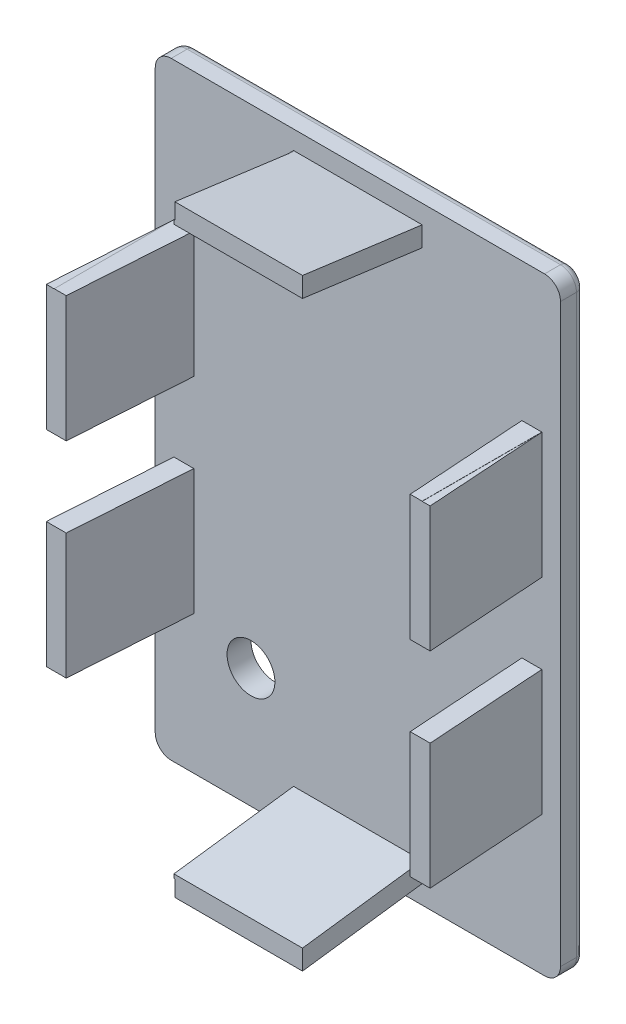
from build123d import *

# Parameters (mm, degrees)
CROQUIS1_W              = 50.8
CROQUIS1_H              = 76.2
SALIENTE_EXTRUIR1_DEPTH = 18
CROQUIS2_W              = 50.8
CROQUIS2_H              = 76.2
CROQUIS2_W_2            = 46.12
CROQUIS2_H_2            = 71.52
CROQUIS2_W_3            = 38.8
CROQUIS2_H_3            = 64.2
CORTAR_EXTRUIR1_DEPTH   = 15
CORTAR_EXTRUIR8_DEPTH   = 15
SALIENTE_EXTRUIR3_DEPTH = 41.5
CORTAR_EXTRUIR9_DEPTH   = 51.5
CORTAR_EXTRUIR10_DEPTH  = 51.5
SALIENTE_EXTRUIR4_DEPTH = 16
CORTAR_EXTRUIR11_DEPTH  = 16.5
REDONDEO3_R             = 2
REDONDEO4_R             = 1
CROQUIS15_W             = 48.12
CROQUIS15_H             = 10
CORTAR_EXTRUIR12_DEPTH  = 15
CROQUIS16_W             = 8
CROQUIS16_H             = 1.5
CORTAR_EXTRUIR13_DEPTH  = 2
CROQUIS17_R             = 3
CORTAR_EXTRUIR14_DEPTH  = 10


with BuildPart() as part:
    # Croquis1 → Saliente-Extruir1 (new body)
    with BuildSketch(Plane.XY):
        Rectangle(CROQUIS1_W, CROQUIS1_H)
    extrude(amount=SALIENTE_EXTRUIR1_DEPTH)

    # Croquis2 → Cortar-Extruir1 (cut)
    # profile 1 of 2: a face of its own
    with BuildSketch(Plane.XY.offset(18)):
        Rectangle(CROQUIS2_W, CROQUIS2_H)
        Rectangle(CROQUIS2_W_2, CROQUIS2_H_2, mode=Mode.SUBTRACT)
    # profile 2 of 2: a face of its own
    with BuildSketch(Plane.XY.offset(18)):
        Rectangle(CROQUIS2_W_3, CROQUIS2_H_3)
    extrude(amount=-CORTAR_EXTRUIR1_DEPTH, mode=Mode.SUBTRACT)

    # Croquis6 → Cortar-Extruir8 (cut)
    with BuildSketch(Plane.XY.offset(18)):
        Polygon((-23.06, 35.76), (-8.06, 35.76), (-8.06, 32.1), (-19.4, 32.1), (-19.4, 20.76), (-23.06, 20.76), align=None)
        Polygon((23.06, 35.76), (8.06, 35.76), (8.06, 32.1), (19.4, 32.1), (19.4, 20.76), (23.06, 20.76), align=None)
        Polygon((-23.06, -35.76), (-23.06, -20.76), (-19.4, -20.76), (-19.4, -32.1), (-8.06, -32.1), (-8.06, -35.76), align=None)
        Polygon((23.06, -35.76), (8.06, -35.76), (8.06, -32.1), (19.4, -32.1), (19.4, -20.76), (23.06, -20.76), align=None)
    extrude(amount=-CORTAR_EXTRUIR8_DEPTH, mode=Mode.SUBTRACT)

    # Croquis10 → Saliente-Extruir3 (add)
    with BuildSketch(Plane(origin=(0, -20.76, 0), x_dir=(-1, 0, 0), z_dir=(0, -1, 0))):
        Polygon((23.06, -18), (24.06, -18), (23.06, -3), align=None)
        Polygon((-23.06, -18), (-24.06, -18), (-23.06, -3), align=None)
    extrude(amount=-SALIENTE_EXTRUIR3_DEPTH)

    # Croquis11 → Cortar-Extruir9 (cut)
    with BuildSketch(Plane.XZ.offset(20.76)):
        Polygon((-19.4, 18), (-21.56, 18), (-20.56, 3), (-19.4, 3), align=None)
    extrude(amount=-CORTAR_EXTRUIR9_DEPTH, mode=Mode.SUBTRACT)

    # Croquis12 → Cortar-Extruir10 (cut)
    with BuildSketch(Plane.XZ.offset(20.76)):
        Polygon((19.4, 18), (19.4, 3), (20.56, 3), (21.56, 18), align=None)
    extrude(amount=-CORTAR_EXTRUIR10_DEPTH, mode=Mode.SUBTRACT)

    # Croquis13 → Saliente-Extruir4 (add)
    with BuildSketch(Plane(origin=(8.06, 0, 0), x_dir=(0, 0, -1), z_dir=(1, 0, 0))):
        Polygon((-18, -35.76), (-18, -37.76), (-3, -35.76), align=None)
        Polygon((-18, 35.76), (-18, 37.76), (-3, 35.76), align=None)
    extrude(amount=-SALIENTE_EXTRUIR4_DEPTH)

    # Croquis14 → Cortar-Extruir11 (cut)
    with BuildSketch(Plane(origin=(8.06, 0, 0), x_dir=(0, 0, -1), z_dir=(1, 0, 0))):
        Polygon((-3, -32.1), (-18, -32.1), (-18, -35.26), (-3, -33.26), align=None)
        Polygon((-18, 32.1), (-18, 35.26), (-3, 33.26), (-3, 32.1), align=None)
    extrude(amount=-CORTAR_EXTRUIR11_DEPTH, mode=Mode.SUBTRACT)

    # Redondeo3
    redondeo3_edges = [part.edges().sort_by_distance(p)[0] for p in [
        (-25.4, 38.1, 1.5),
        (25.4, 38.1, 1.5),
        (25.4, -38.1, 1.5),
        (-25.4, -38.1, 1.5),
    ]]
    fillet(redondeo3_edges, radius=REDONDEO3_R)

    # Redondeo4
    redondeo4_edges = [part.edges().sort_by_distance(p)[0] for p in [
        (0, 38.1, 0),
        (-25.4, 0, 0),
        (25.4, 0, 0),
        (0, -38.1, 0),
        (24.814213562, -37.514213562, 0),
        (-24.814213562, -37.514213562, 0),
        (-24.814213562, 37.514213562, 0),
        (24.814213562, 37.514213562, 0),
    ]]
    fillet(redondeo4_edges, radius=REDONDEO4_R)

    # Croquis15 → Cortar-Extruir12 (cut)
    with BuildSketch(Plane.XY.offset(18)):
        with Locations((0, -0.01)):
            Rectangle(CROQUIS15_W, CROQUIS15_H)
    extrude(amount=-CORTAR_EXTRUIR12_DEPTH, mode=Mode.SUBTRACT)

    # Croquis16 → Cortar-Extruir13 (cut)
    with BuildSketch(Plane.XZ.offset(38.1)):
        with Locations((0, 2.25)):
            Rectangle(CROQUIS16_W, CROQUIS16_H)
    extrude(amount=-CORTAR_EXTRUIR13_DEPTH, mode=Mode.SUBTRACT)

    # Croquis17 → Cortar-Extruir14 (cut)
    with BuildSketch(Plane.XY.offset(3)):
        with Locations((-13.4, -23.1)):
            Circle(CROQUIS17_R)
    extrude(amount=-CORTAR_EXTRUIR14_DEPTH, mode=Mode.SUBTRACT)


solid = part.part
